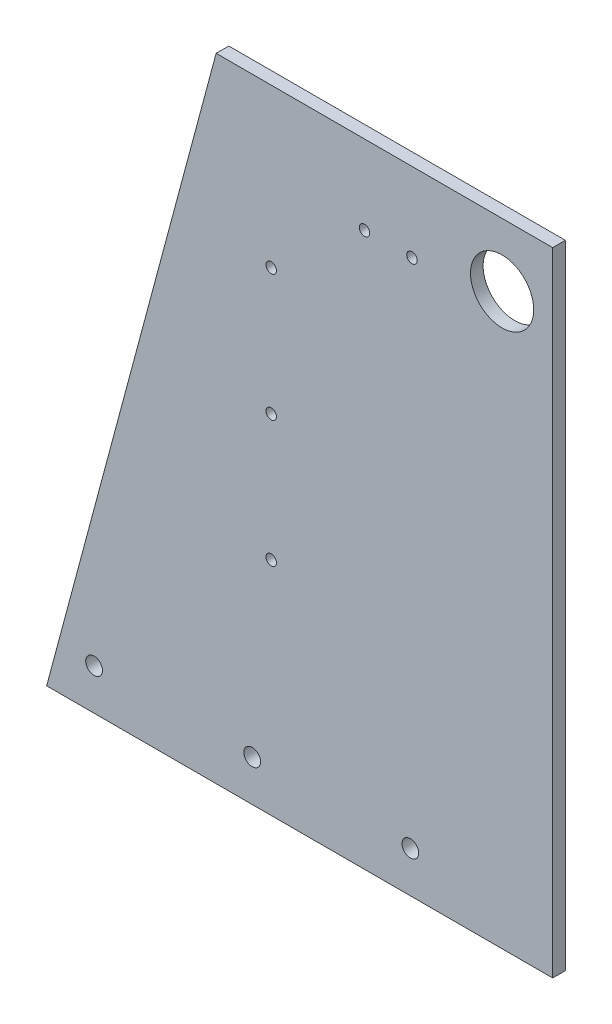
from build123d import *

# Parameters (mm, degrees)
SKETCH_2_R      = 2.65
SKETCH_2_R_2    = 1.65
SKETCH_2_R_3    = 10
EXTRUDE_1_DEPTH = 4


with BuildPart() as part:
    # 草图2 → 凸台-拉伸1 (new body)
    with BuildSketch(Plane.XY):
        Polygon((80, 100), (-26.410161514, 100), (-80, -100), (80, -100), align=None)
        with Locations((-65, -87)):
            Circle(SKETCH_2_R, mode=Mode.SUBTRACT)
        with Locations((-15, -87)):
            Circle(SKETCH_2_R, mode=Mode.SUBTRACT)
        with Locations((-9, -30)):
            Circle(SKETCH_2_R_2, mode=Mode.SUBTRACT)
        with Locations((35, -87)):
            Circle(SKETCH_2_R, mode=Mode.SUBTRACT)
        with Locations((-9, 10)):
            Circle(SKETCH_2_R_2, mode=Mode.SUBTRACT)
        with Locations((-9, 50)):
            Circle(SKETCH_2_R_2, mode=Mode.SUBTRACT)
        with Locations((20.5, 75)):
            Circle(SKETCH_2_R_2, mode=Mode.SUBTRACT)
        with Locations((35.5, 75)):
            Circle(SKETCH_2_R_2, mode=Mode.SUBTRACT)
        with Locations((64, 80)):
            Circle(SKETCH_2_R_3, mode=Mode.SUBTRACT)
    extrude(amount=EXTRUDE_1_DEPTH)


solid = part.part
